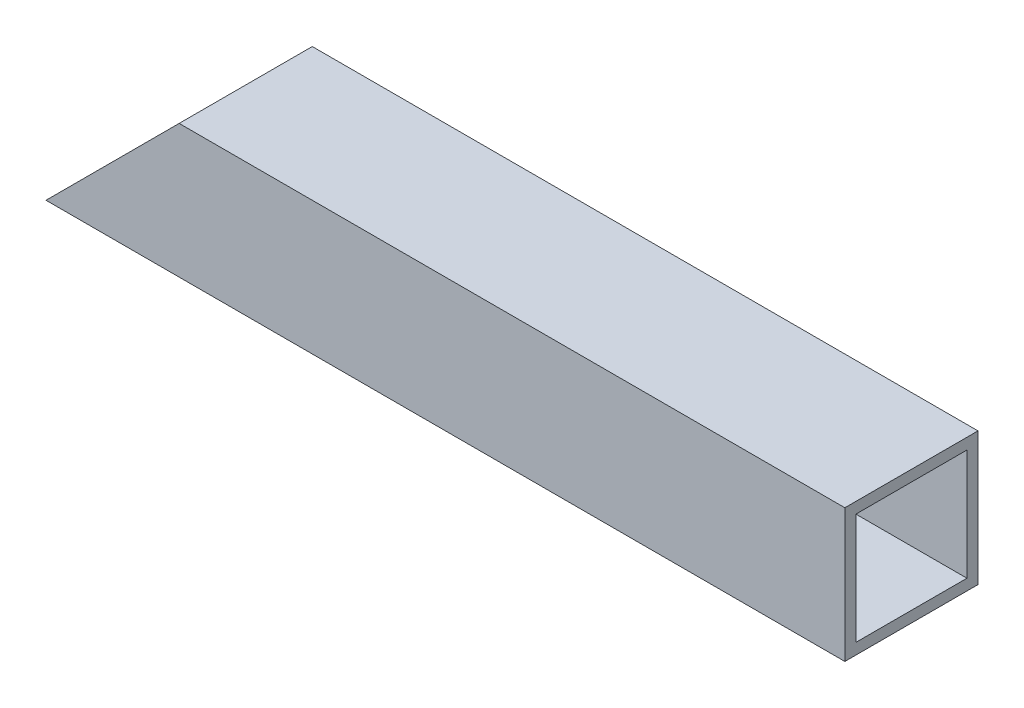
from build123d import *

# Parameters (mm, degrees)
SKETCH1_W                              = 25.4
SKETCH1_H                              = 25.4
SKETCH1_W_2                            = 21.1836
SKETCH1_H_2                            = 21.1836
AL_TUBE_SQUARE_1_SQ_X_083_WALL_1_DEPTH = 152.4
CORTAR_EXTRUIR1_DEPTH                  = 58.928


with BuildPart() as part:
    # Sketch1 → Al tube (square) 1 SQ X .083 WALL(1) (new body)
    with BuildSketch(Plane.YZ):
        Rectangle(SKETCH1_W, SKETCH1_H)
        Rectangle(SKETCH1_W_2, SKETCH1_H_2, mode=Mode.SUBTRACT)
    extrude(amount=AL_TUBE_SQUARE_1_SQ_X_083_WALL_1_DEPTH)

    # Croquis3 → Cortar-Extruir1 (cut)
    with BuildSketch(Plane.XY.offset(12.7)):
        Polygon((0, -12.7), (25.4, 12.7), (0, 12.7), align=None)
    extrude(amount=-CORTAR_EXTRUIR1_DEPTH, mode=Mode.SUBTRACT)


solid = part.part
